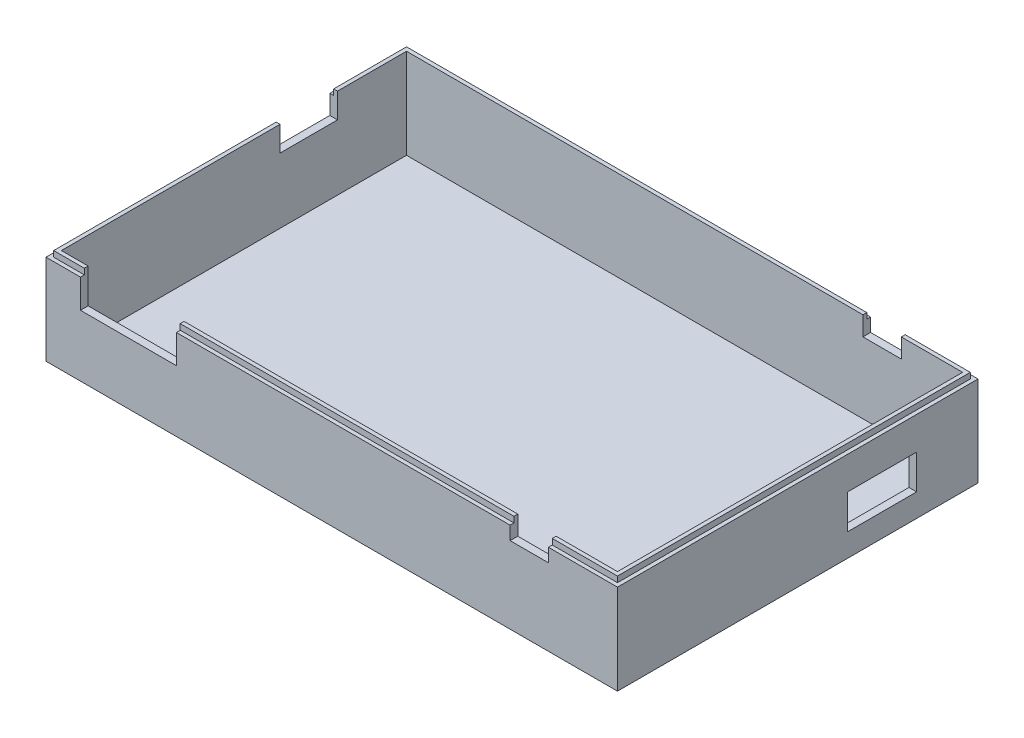
from build123d import *

# Parameters (mm, degrees)
SKETCH2_W           = 145
SKETCH2_H           = 90
BOSS_EXTRUDE1_DEPTH = 1.5
SKETCH3_W           = 149
SKETCH3_H           = 94
SKETCH3_W_2         = 145
SKETCH3_H_2         = 90
BOSS_EXTRUDE2_DEPTH = 25
CUT_EXTRUDE1_REACH  = 124.52
SKETCH4_W           = 25
SKETCH4_H           = 15
CUT_EXTRUDE2_REACH  = 160.225
SKETCH5_W           = 18
SKETCH5_H           = 9
SKETCH6_W           = 10
SKETCH6_H           = 5
CUT_EXTRUDE3_DEPTH  = 123.520406464
CUT_EXTRUDE4_REACH  = 160.225
SKETCH7_W           = 15
SKETCH7_H           = 6.5
SKETCH9_W           = 87
SKETCH9_H           = 1
CUT_EXTRUDE5_DEPTH  = 1.5


with BuildPart() as part:
    # Sketch2 → Boss-Extrude1 (new body)
    with BuildSketch(Plane(origin=(0, 0, 0), x_dir=(1, 0, 0), z_dir=(0, 1, 0))):
        Rectangle(SKETCH2_W, SKETCH2_H)
    extrude(amount=BOSS_EXTRUDE1_DEPTH)

    # Sketch3 → Boss-Extrude2 (add)
    with BuildSketch(Plane(origin=(0, 0, 0), x_dir=(1, 0, 0), z_dir=(0, 1, 0))):
        Rectangle(SKETCH3_W, SKETCH3_H)
        Rectangle(SKETCH3_W_2, SKETCH3_H_2, mode=Mode.SUBTRACT)
    extrude(amount=BOSS_EXTRUDE2_DEPTH)

    # Sketch4 → Cut-Extrude1 (cut, up to next)
    with BuildSketch(Plane.XY.offset(47), mode=Mode.PRIVATE) as cut_extrude1_sk1:
        with Locations((-53, 23.5)):
            Rectangle(SKETCH4_W, SKETCH4_H)
    cut_extrude1_tool1 = extrude(cut_extrude1_sk1.sketch, amount=-CUT_EXTRUDE1_REACH, mode=Mode.PRIVATE) & part.part
    add(cut_extrude1_tool1.solids().sort_by_distance((-53, 23.5, 47))[0], mode=Mode.SUBTRACT)

    # Sketch5 → Cut-Extrude2 (cut, up to next)
    with BuildSketch(Plane(origin=(74.5, 0, 0), x_dir=(0, 0, -1), z_dir=(1, 0, 0)), mode=Mode.PRIVATE) as cut_extrude2_sk1:
        with Locations((22, 10.5)):
            Rectangle(SKETCH5_W, SKETCH5_H)
    cut_extrude2_tool1 = extrude(cut_extrude2_sk1.sketch, amount=-CUT_EXTRUDE2_REACH, mode=Mode.PRIVATE) & part.part
    add(cut_extrude2_tool1.solids().sort_by_distance((74.5, 10.5, -22))[0], mode=Mode.SUBTRACT)

    # Sketch6 → Cut-Extrude3 (cut, through all)
    with BuildSketch(Plane.XY.offset(47)):
        with Locations((51.5, 22.5)):
            Rectangle(SKETCH6_W, SKETCH6_H)
    extrude(amount=-CUT_EXTRUDE3_DEPTH, mode=Mode.SUBTRACT)

    # Sketch7 → Cut-Extrude4 (cut, up to next)
    with BuildSketch(Plane.ZY.offset(74.5), mode=Mode.PRIVATE) as cut_extrude4_sk1:
        with Locations((-19.5, 21.75)):
            Rectangle(SKETCH7_W, SKETCH7_H)
    cut_extrude4_tool1 = extrude(cut_extrude4_sk1.sketch, amount=-CUT_EXTRUDE4_REACH, mode=Mode.PRIVATE) & part.part
    add(cut_extrude4_tool1.solids().sort_by_distance((-74.5, 21.75, -19.5))[0], mode=Mode.SUBTRACT)

    # Sketch9 → Cut-Extrude5 (cut)
    with BuildSketch(Plane(origin=(0, 25, 0), x_dir=(1, 0, 0), z_dir=(0, 1, 0))):
        Polygon((-73.5, 12), (-74.5, 12), (-74.5, -47), (-65.5, -47), (-65.5, -46), (-73.5, -46), align=None)
        Polygon((-74.5, 27), (-73.5, 27), (-73.5, 46), (46.5, 46), (46.5, 47), (-74.5, 47), align=None)
        Polygon((56.5, -46), (56.5, -47), (74.5, -47), (74.5, 47), (56.5, 47), (56.5, 46), (73.5, 46), (73.5, -46), align=None)
        with Locations((3, -46.5)):
            Rectangle(SKETCH9_W, SKETCH9_H)
    extrude(amount=-CUT_EXTRUDE5_DEPTH, mode=Mode.SUBTRACT)


solid = part.part
